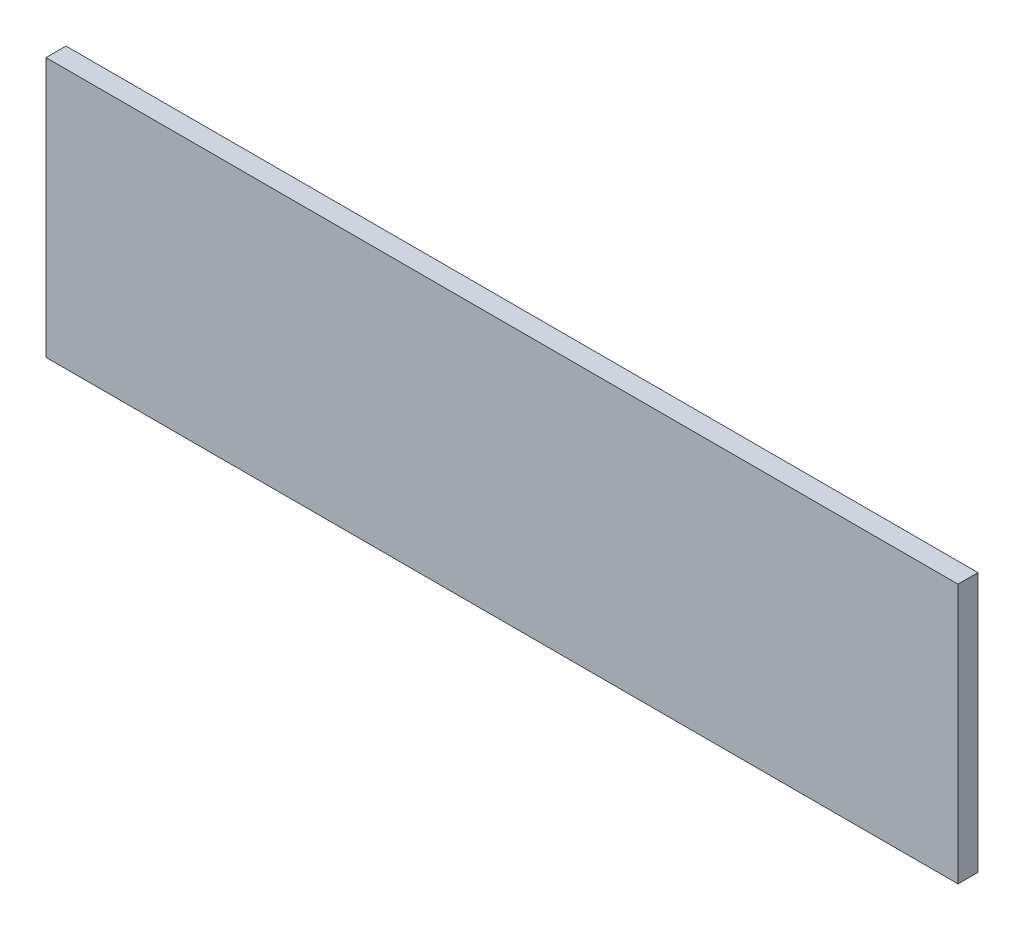
from build123d import *

# Parameters (mm, degrees)
SKETCH1_W           = 274
SKETCH1_H           = 78
BOSS_EXTRUDE1_DEPTH = 6


with BuildPart() as part:
    # Sketch1 → Boss-Extrude1 (new body)
    with BuildSketch(Plane.XY):
        Rectangle(SKETCH1_W, SKETCH1_H)
    extrude(amount=BOSS_EXTRUDE1_DEPTH)


solid = part.part
